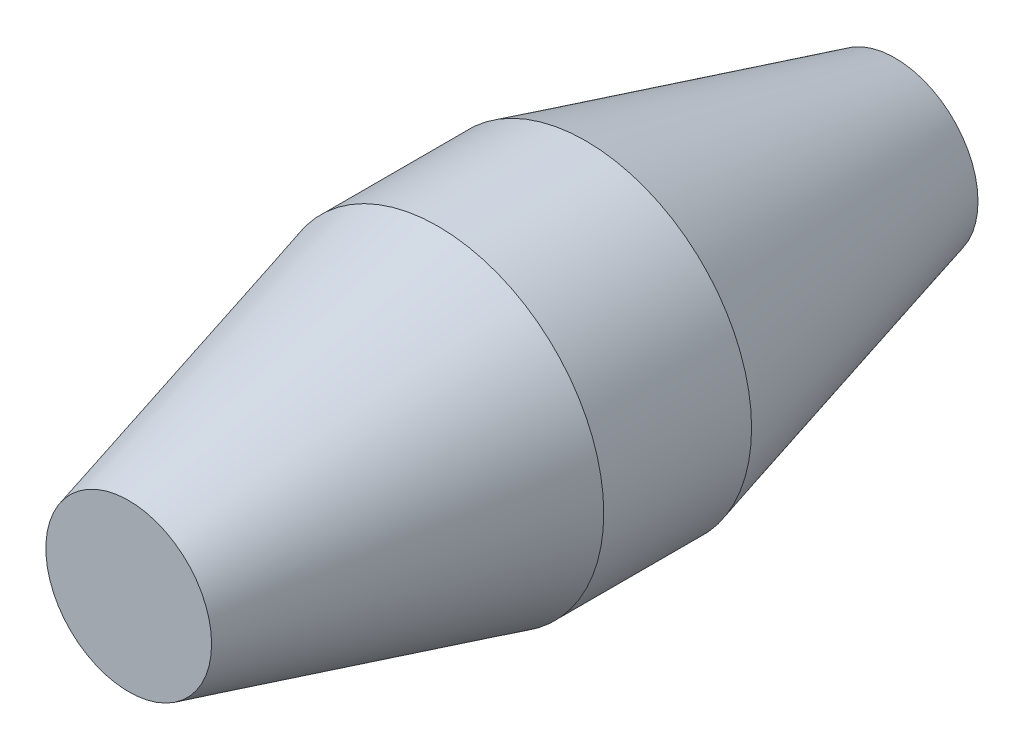
from build123d import *

# Parameters (mm, degrees)
SKETCH1_R           = 12.7
BOSS_EXTRUDE1_DEPTH = 58.7248
CHAMFER3_SIZE       = 6.35
CHAMFER3_SIZE2      = 23.698522628
CHAMFER4_SIZE       = 6.35
CHAMFER4_SIZE2      = 23.698522628


with BuildPart() as part:
    # Sketch1 → Boss-Extrude1 (new body)
    with BuildSketch(Plane.XY):
        Circle(SKETCH1_R)
    extrude(amount=-BOSS_EXTRUDE1_DEPTH)

    # Chamfer3
    chamfer3_edges = [part.edges().sort_by_distance(p)[0] for p in [
        (-12.7, 0, -58.7248),
    ]]
    chamfer3_side = [part.faces().sort_by_distance(p)[0] for p in [
        (0, 0, -58.7248),
    ]]
    chamfer(chamfer3_edges, length=CHAMFER3_SIZE, length2=CHAMFER3_SIZE2, reference=chamfer3_side[0])

    # Chamfer4
    chamfer4_edges = [part.edges().sort_by_distance(p)[0] for p in [
        (-12.7, 0, 0),
    ]]
    chamfer4_side = [part.faces().sort_by_distance(p)[0] for p in [
        (0, 0, 0),
    ]]
    chamfer(chamfer4_edges, length=CHAMFER4_SIZE, length2=CHAMFER4_SIZE2, reference=chamfer4_side[0])


solid = part.part
